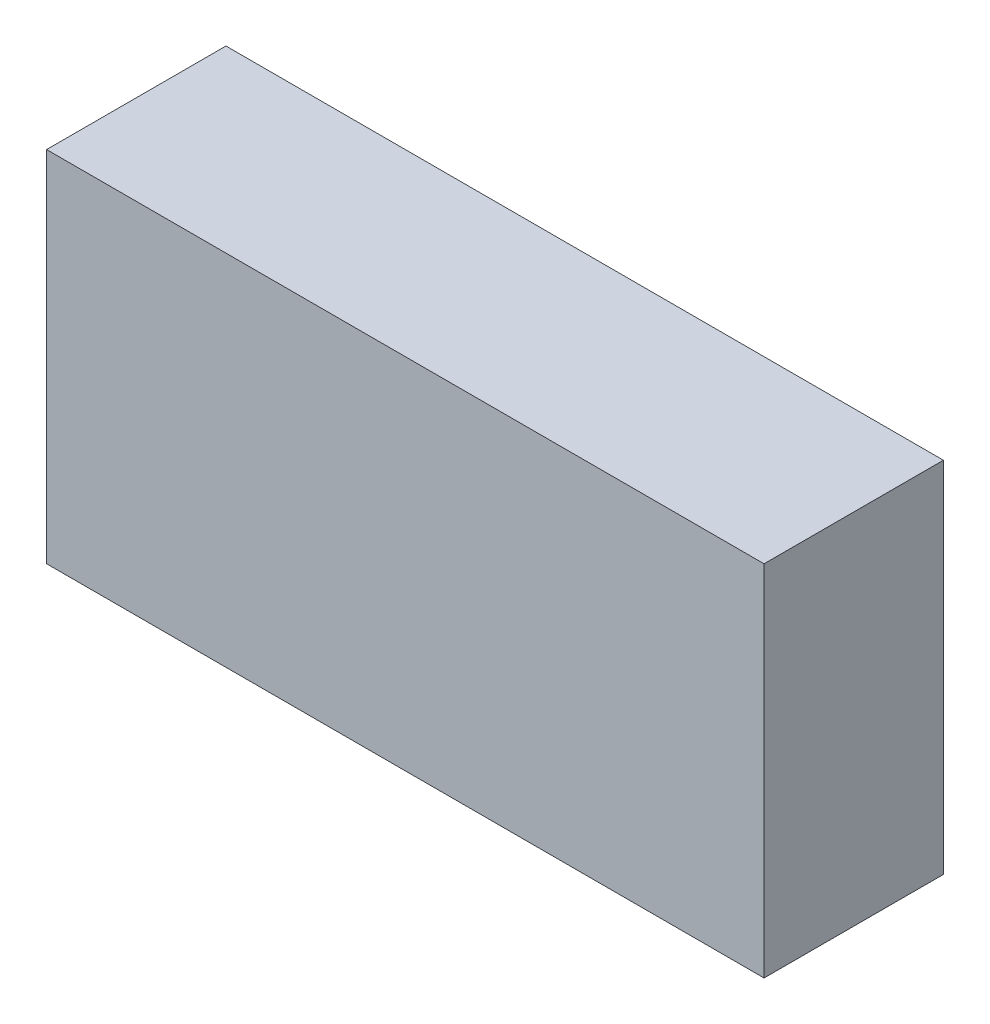
from build123d import *

# Parameters (mm, degrees)
SKETCH_1_W      = 200
SKETCH_1_H      = 100
EXTRUDE_1_DEPTH = 50


with BuildPart() as part:
    # ｽｹｯﾁ1 → ﾎﾞｽ - 押し出し1 (new body)
    with BuildSketch(Plane.XY):
        with Locations((100, 50)):
            Rectangle(SKETCH_1_W, SKETCH_1_H)
    extrude(amount=EXTRUDE_1_DEPTH)


solid = part.part
